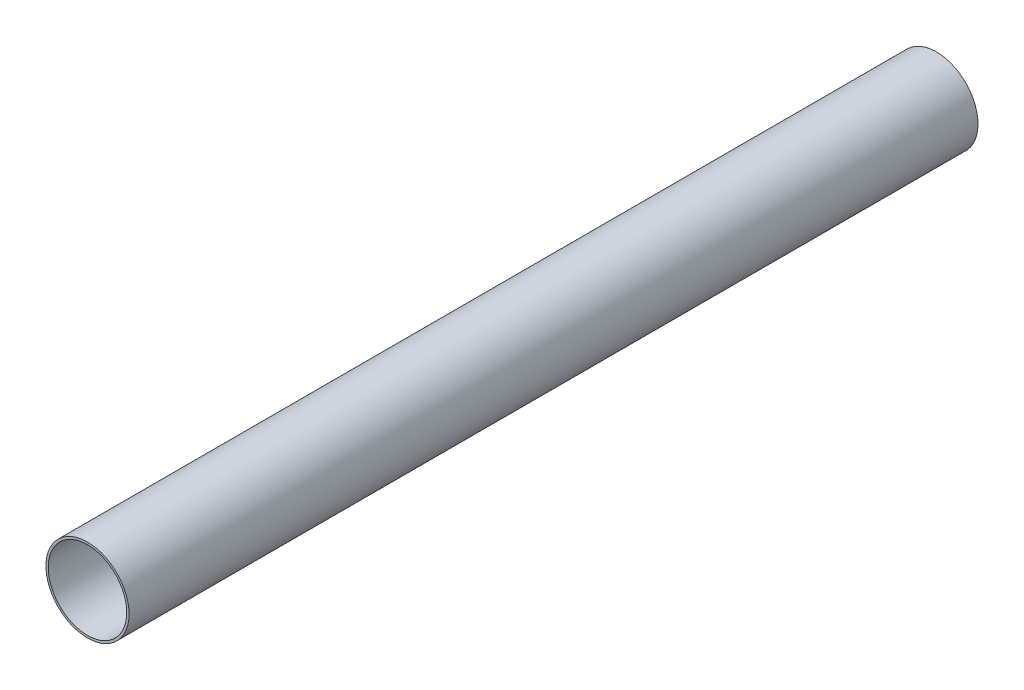
from build123d import *

# Parameters (mm, degrees)
SKETCH1_R           = 12.7
SKETCH1_R_2         = 12
BOSS_EXTRUDE1_DEPTH = 259.43


with BuildPart() as part:
    # Sketch1 → Boss-Extrude1 (new body)
    with BuildSketch(Plane.XY):
        Circle(SKETCH1_R)
        Circle(SKETCH1_R_2, mode=Mode.SUBTRACT)
    extrude(amount=-BOSS_EXTRUDE1_DEPTH)


solid = part.part
